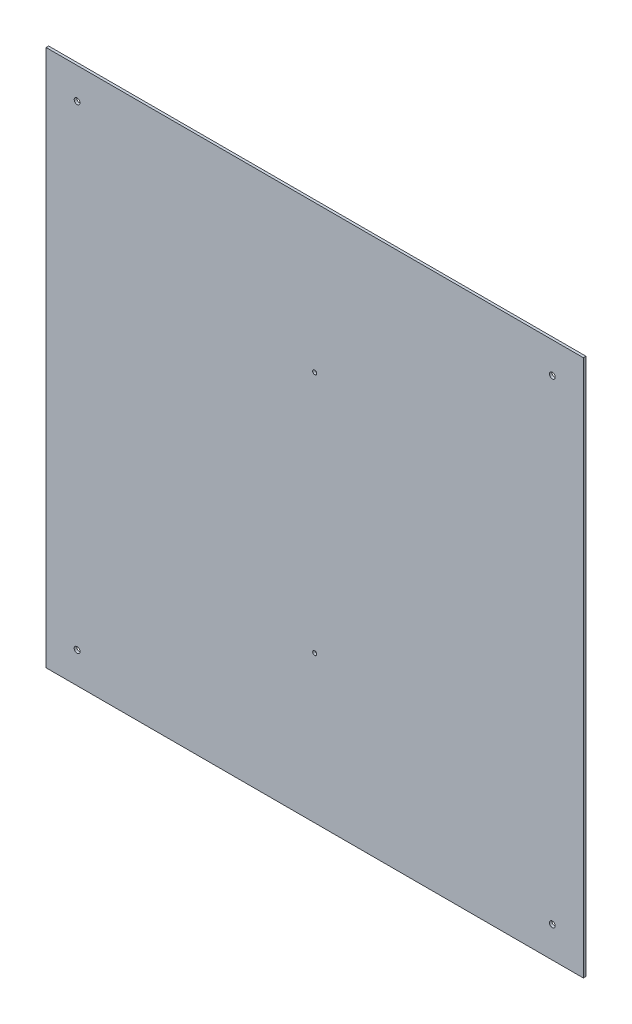
from build123d import *

# Parameters (mm, degrees)
SKETCH1_W           = 660.4
SKETCH1_H           = 660.4
SKETCH1_R           = 2.5
SKETCH1_R_2         = 3.556
BOSS_EXTRUDE1_DEPTH = 3.175


with BuildPart() as part:
    # Sketch1 → Boss-Extrude1 (new body)
    with BuildSketch(Plane.XY):
        with Locations((330.2, 330.2)):
            Rectangle(SKETCH1_W, SKETCH1_H)
        with Locations((330.2, 479.679)):
            Circle(SKETCH1_R, mode=Mode.SUBTRACT)
        with Locations((330.2, 180.721)):
            Circle(SKETCH1_R, mode=Mode.SUBTRACT)
        with Locations((38.1, 622.3)):
            Circle(SKETCH1_R_2, mode=Mode.SUBTRACT)
        with Locations((622.3, 622.3)):
            Circle(SKETCH1_R_2, mode=Mode.SUBTRACT)
        with Locations((622.3, 38.1)):
            Circle(SKETCH1_R_2, mode=Mode.SUBTRACT)
        with Locations((38.1, 38.1)):
            Circle(SKETCH1_R_2, mode=Mode.SUBTRACT)
    extrude(amount=BOSS_EXTRUDE1_DEPTH)


solid = part.part
